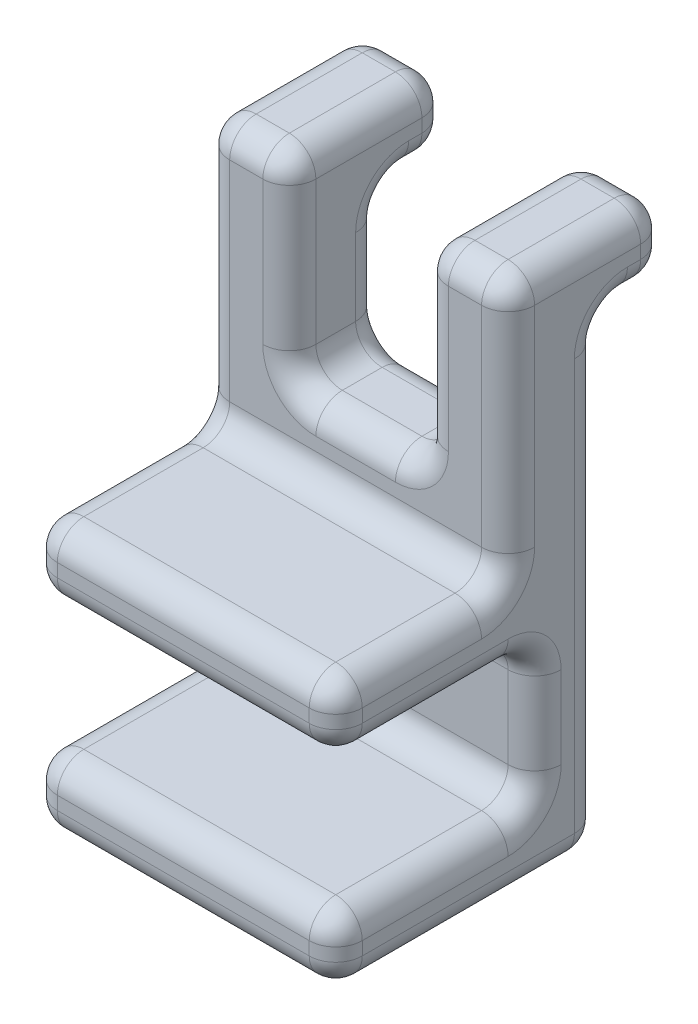
from build123d import *

# Parameters (mm, degrees)
SKETCH1_W                      = 23
SKETCH1_H                      = 40
BOSS_EXTRUDE1_DEPTH            = 20
SKETCH2_W                      = 15
SKETCH2_H                      = 10.2
CUT_EXTRUDE1_DEPTH             = 51.289163843
FILLET1_R                      = 2
SKETCH4_W                      = 13
SKETCH4_H                      = 19.8
CUT_EXTRUDE3_DEPTH             = 51.289163843
SKETCH6_W                      = 23
SKETCH6_H                      = 5
BOSS_EXTRUDE2_DEPTH            = 5
CUT_EXTRUDE4_REACH             = 52.289
SKETCH5_W                      = 10
SKETCH5_H                      = 14.8
CUT_EXTRUDE4_DIRECTION_2_DEPTH = 51.289163843
FILLET11_R                     = 2


with BuildPart() as part:
    # Sketch1 → Boss-Extrude1 (new body)
    with BuildSketch(Plane.XY):
        with Locations((-11.5, 20)):
            Rectangle(SKETCH1_W, SKETCH1_H)
    extrude(amount=BOSS_EXTRUDE1_DEPTH)

    # Sketch2 → Cut-Extrude1 (cut, through all)
    with BuildSketch(Plane(origin=(0, 0, 0), x_dir=(0, 0, -1), z_dir=(1, 0, 0))):
        with Locations((-12.5, 10.1)):
            Rectangle(SKETCH2_W, SKETCH2_H)
    extrude(amount=-CUT_EXTRUDE1_DEPTH, mode=Mode.SUBTRACT)

    # Fillet1
    fillet1_edges = [part.edges().sort_by_distance(p)[0] for p in [
        (-23, 15.2, 12.5),
        (-23, 10.1, 5),
        (-11.5, 15.2, 5),
        (-23, 5, 12.5),
        (-11.5, 5, 5),
        (0, 5, 12.5),
        (0, 10.1, 5),
        (0, 15.2, 12.5),
    ]]
    fillet(fillet1_edges, radius=FILLET1_R)

    # Sketch4 → Cut-Extrude3 (cut, through all)
    with BuildSketch(Plane.ZY.offset(23)):
        with Locations((13.5, 30.1)):
            Rectangle(SKETCH4_W, SKETCH4_H)
    extrude(amount=-CUT_EXTRUDE3_DEPTH, mode=Mode.SUBTRACT)

    # Sketch6 → Boss-Extrude2 (add)
    with BuildSketch(Plane(origin=(0, 0, 0), x_dir=(-1, 0, 0), z_dir=(0, 0, -1))):
        with Locations((11.5, 37.5)):
            Rectangle(SKETCH6_W, SKETCH6_H)
    extrude(amount=BOSS_EXTRUDE2_DEPTH)

    # Sketch5 → Cut-Extrude4 (cut, up to next)
    with BuildSketch(Plane(origin=(0, 0, 0), x_dir=(-1, 0, 0), z_dir=(0, 0, -1)), mode=Mode.PRIVATE) as cut_extrude4_sk1:
        with Locations((11.5, 32.6)):
            Rectangle(SKETCH5_W, SKETCH5_H)
    cut_extrude4_tool1 = extrude(cut_extrude4_sk1.sketch, amount=-CUT_EXTRUDE4_REACH, mode=Mode.PRIVATE) & part.part
    add(cut_extrude4_tool1.solids().sort_by_distance((-11.5, 32.6, 0))[0], mode=Mode.SUBTRACT)

    # Sketch5 → Cut-Extrude4 direction 2 (cut)
    with BuildSketch(Plane(origin=(0, 0, 0), x_dir=(-1, 0, 0), z_dir=(0, 0, -1))):
        with Locations((11.5, 32.6)):
            Rectangle(SKETCH5_W, SKETCH5_H)
    extrude(amount=CUT_EXTRUDE4_DIRECTION_2_DEPTH, mode=Mode.SUBTRACT)

    # Fillet11
    fillet11_edges = [part.edges().sort_by_distance(p)[0] for p in [
        (-16.5, 25.2, 3.5),
        (-6.5, 35, -2.5),
        (-6.5, 30.1, 0),
        (-11.5, 25.2, 0),
        (-16.5, 30.1, 0),
        (-16.5, 35, -2.5),
        (-16.5, 40, 1),
        (-11.5, 25.2, 7),
        (-6.5, 32.6, 7),
        (-16.5, 32.6, 7),
        (-11.5, 0, 20),
        (-23, 1.5, 20),
        (-11.5, 5, 20),
        (-0.585786438, 4.414213562, 20),
        (-22.414213562, 4.414213562, 20),
        (0, 18.7, 20),
        (-11.5, 15.2, 20),
        (-0.585786438, 15.785786438, 20),
        (-22.414213562, 15.785786438, 20),
        (0, 1.5, 20),
        (-11.5, 0, 0),
        (0, 17.5, 0),
        (-23, 18.7, 20),
        (-23, 40, 1),
        (0, 40, 1),
        (0, 20.2, 13.5),
        (-11.5, 20.2, 20),
        (0, 30.1, 7),
        (-11.5, 20.2, 7),
        (-3.25, 40, 7),
        (-23, 30.1, 7),
        (-23, 20.2, 13.5),
        (-23, 17.5, 0),
        (0, 0, 10),
        (-3.25, 35, 0),
        (-23, 0, 10),
        (0, 35, -2.5),
        (-23, 35, -2.5),
        (0, 37.5, -5),
        (-3.25, 35, -5),
        (-23, 37.5, -5),
        (-19.75, 40, -5),
        (-19.75, 35, -5),
        (-3.25, 40, -5),
        (-16.5, 37.5, -5),
        (-19.75, 35, 0),
        (-19.75, 40, 7),
        (-6.5, 25.2, 3.5),
        (-6.5, 37.5, -5),
        (-6.5, 40, 1),
    ]]
    fillet(fillet11_edges, radius=FILLET11_R)


solid = part.part
